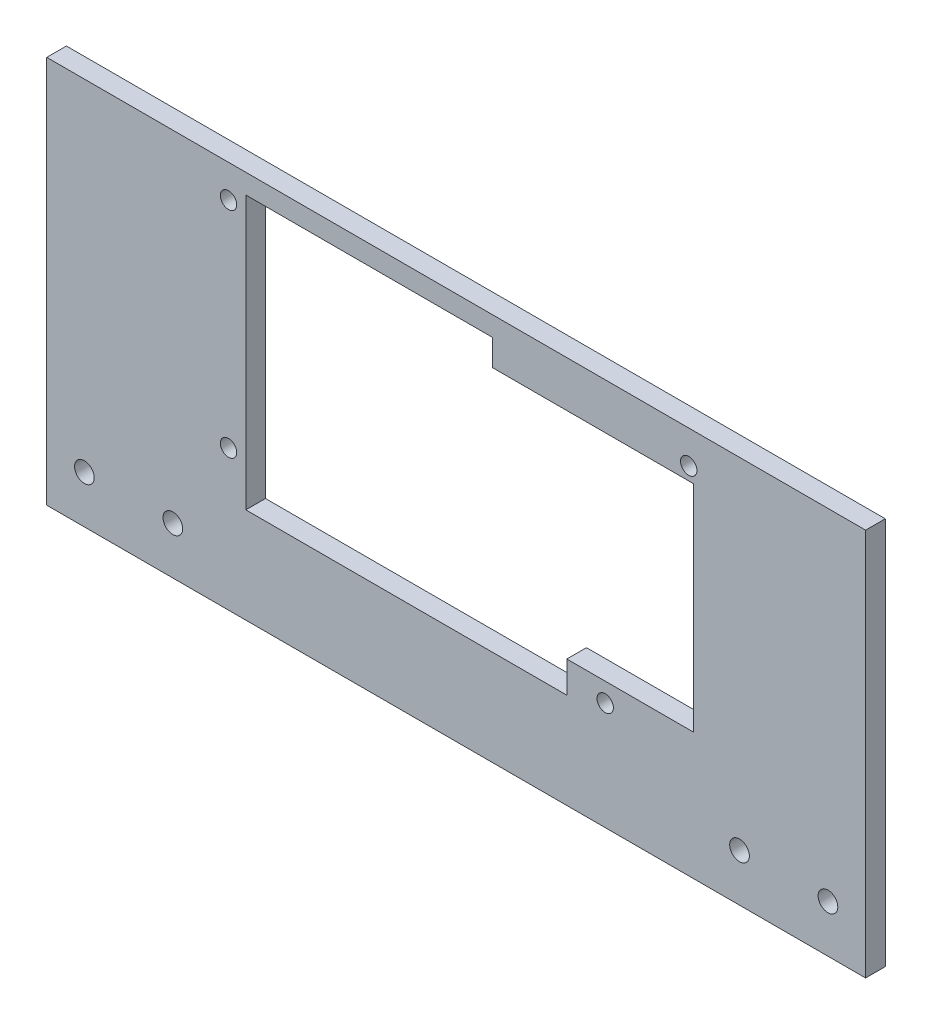
from build123d import *

# Parameters (mm, degrees)
ESQUISSE1_W             = 250
ESQUISSE1_H             = 118.414906094
BOSS_EXTRU_1_DEPTH      = 6
ENL_V_MAT_EXTRU_1_REACH = 231.506
ENL_V_MAT_EXTRU_2_REACH = 231.506
ESQUISSE3_R             = 2.5
ENL_V_MAT_EXTRU_3_REACH = 231.506
ESQUISSE4_R             = 3


with BuildPart() as part:
    # Esquisse1 → Boss.-Extru.1 (new body)
    with BuildSketch(Plane.XY):
        with Locations((75, -53.207453047)):
            Rectangle(ESQUISSE1_W, ESQUISSE1_H)
    extrude(amount=BOSS_EXTRU_1_DEPTH)

    # Esquisse2 → Enlèv. mat.-Extru.1 (cut, up to next)
    with BuildSketch(Plane(origin=(0, 0, 0), x_dir=(-1, 0, 0), z_dir=(0, 0, -1)), mode=Mode.PRIVATE) as enl_v_mat_extru_1_sk1:
        Polygon((-10.782435162, 0), (-10.782435162, -83.25), (-108.778675483, -83.25), (-108.778675483, -73.68186315), (-147.5, -73.68186315), (-147.5, -8), (-86.152674603, -8), (-86.152674603, 0), align=None)
    enl_v_mat_extru_1_tool1 = extrude(enl_v_mat_extru_1_sk1.sketch, amount=-ENL_V_MAT_EXTRU_1_REACH, mode=Mode.PRIVATE) & part.part
    add(enl_v_mat_extru_1_tool1.solids().sort_by_distance((75.657683, -42.082804, 0))[0], mode=Mode.SUBTRACT)

    # Esquisse3 → Enlèv. mat.-Extru.2 (cut, up to next)
    with BuildSketch(Plane(origin=(0, 0, 0), x_dir=(-1, 0, 0), z_dir=(0, 0, -1)), mode=Mode.PRIVATE) as enl_v_mat_extru_2_sk1:
        with Locations((-5.5, -69.5)):
            Circle(ESQUISSE3_R)
    enl_v_mat_extru_2_tool1 = extrude(enl_v_mat_extru_2_sk1.sketch, amount=-ENL_V_MAT_EXTRU_2_REACH, mode=Mode.PRIVATE) & part.part
    # Esquisse3 → Enlèv. mat.-Extru.2 (cut, up to next)
    with BuildSketch(Plane(origin=(0, 0, 0), x_dir=(-1, 0, 0), z_dir=(0, 0, -1)), mode=Mode.PRIVATE) as enl_v_mat_extru_2_sk2:
        with Locations((-5.5, -4)):
            Circle(ESQUISSE3_R)
    enl_v_mat_extru_2_tool2 = extrude(enl_v_mat_extru_2_sk2.sketch, amount=-ENL_V_MAT_EXTRU_2_REACH, mode=Mode.PRIVATE) & part.part
    # Esquisse3 → Enlèv. mat.-Extru.2 (cut, up to next)
    with BuildSketch(Plane(origin=(0, 0, 0), x_dir=(-1, 0, 0), z_dir=(0, 0, -1)), mode=Mode.PRIVATE) as enl_v_mat_extru_2_sk3:
        with Locations((-146, -4)):
            Circle(ESQUISSE3_R)
    enl_v_mat_extru_2_tool3 = extrude(enl_v_mat_extru_2_sk3.sketch, amount=-ENL_V_MAT_EXTRU_2_REACH, mode=Mode.PRIVATE) & part.part
    # Esquisse3 → Enlèv. mat.-Extru.2 (cut, up to next)
    with BuildSketch(Plane(origin=(0, 0, 0), x_dir=(-1, 0, 0), z_dir=(0, 0, -1)), mode=Mode.PRIVATE) as enl_v_mat_extru_2_sk4:
        with Locations((-120.5, -79.5)):
            Circle(ESQUISSE3_R)
    enl_v_mat_extru_2_tool4 = extrude(enl_v_mat_extru_2_sk4.sketch, amount=-ENL_V_MAT_EXTRU_2_REACH, mode=Mode.PRIVATE) & part.part
    add(enl_v_mat_extru_2_tool1.solids().sort_by_distance((5.5, -69.5, 0))[0], mode=Mode.SUBTRACT)
    add(enl_v_mat_extru_2_tool2.solids().sort_by_distance((5.5, -4, 0))[0], mode=Mode.SUBTRACT)
    add(enl_v_mat_extru_2_tool3.solids().sort_by_distance((146, -4, 0))[0], mode=Mode.SUBTRACT)
    add(enl_v_mat_extru_2_tool4.solids().sort_by_distance((120.5, -79.5, 0))[0], mode=Mode.SUBTRACT)

    # Esquisse4 → Enlèv. mat.-Extru.3 (cut, up to next)
    with BuildSketch(Plane(origin=(0, 0, 0), x_dir=(-1, 0, 0), z_dir=(0, 0, -1)), mode=Mode.PRIVATE) as enl_v_mat_extru_3_sk1:
        with Locations((-188.5, -97.914906094)):
            Circle(ESQUISSE4_R)
    enl_v_mat_extru_3_tool1 = extrude(enl_v_mat_extru_3_sk1.sketch, amount=-ENL_V_MAT_EXTRU_3_REACH, mode=Mode.PRIVATE) & part.part
    # Esquisse4 → Enlèv. mat.-Extru.3 (cut, up to next)
    with BuildSketch(Plane(origin=(0, 0, 0), x_dir=(-1, 0, 0), z_dir=(0, 0, -1)), mode=Mode.PRIVATE) as enl_v_mat_extru_3_sk2:
        with Locations((-161.5, -97.914906094)):
            Circle(ESQUISSE4_R)
    enl_v_mat_extru_3_tool2 = extrude(enl_v_mat_extru_3_sk2.sketch, amount=-ENL_V_MAT_EXTRU_3_REACH, mode=Mode.PRIVATE) & part.part
    enl_v_mat_extru_3_1 = enl_v_mat_extru_3_tool1.solids().sort_by_distance((188.5, -97.914906, 0))[0]
    add(enl_v_mat_extru_3_1, mode=Mode.SUBTRACT)
    enl_v_mat_extru_3_2 = enl_v_mat_extru_3_tool2.solids().sort_by_distance((161.5, -97.914906, 0))[0]
    add(enl_v_mat_extru_3_2, mode=Mode.SUBTRACT)
    enl_v_mat_extru_3 = enl_v_mat_extru_3_1 + enl_v_mat_extru_3_2  # Enlèv. mat.-Extru.3 as one shape, for the pattern or mirror that repeats it

    # Symétrie1: Enlèv. mat.-Extru.3 across plane
    add(enl_v_mat_extru_3.mirror(Plane(origin=(75, 0, 0), x_dir=(0, 0, 1), z_dir=(1, 0, 0))), mode=Mode.SUBTRACT)


solid = part.part
